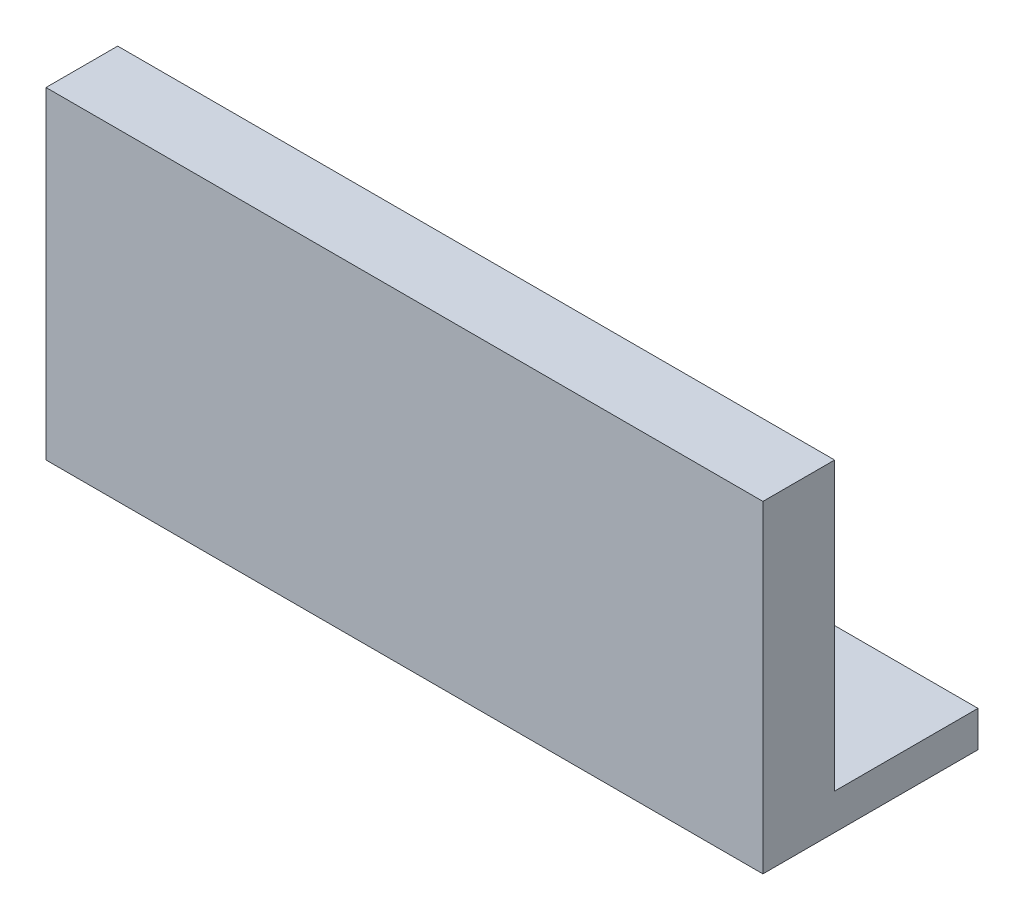
from build123d import *

# Parameters (mm, degrees)
SALIENTE_EXTRUIR1_DEPTH = 1000


with BuildPart() as part:
    # Croquis1 → Saliente-Extruir1 (new body)
    with BuildSketch(Plane(origin=(0, 0, 0), x_dir=(0, 0, -1), z_dir=(1, 0, 0))):
        Polygon((0, 0), (0, 450), (100, 450), (100, 50), (300, 50), (300, 0), align=None)
    extrude(amount=SALIENTE_EXTRUIR1_DEPTH)


solid = part.part
